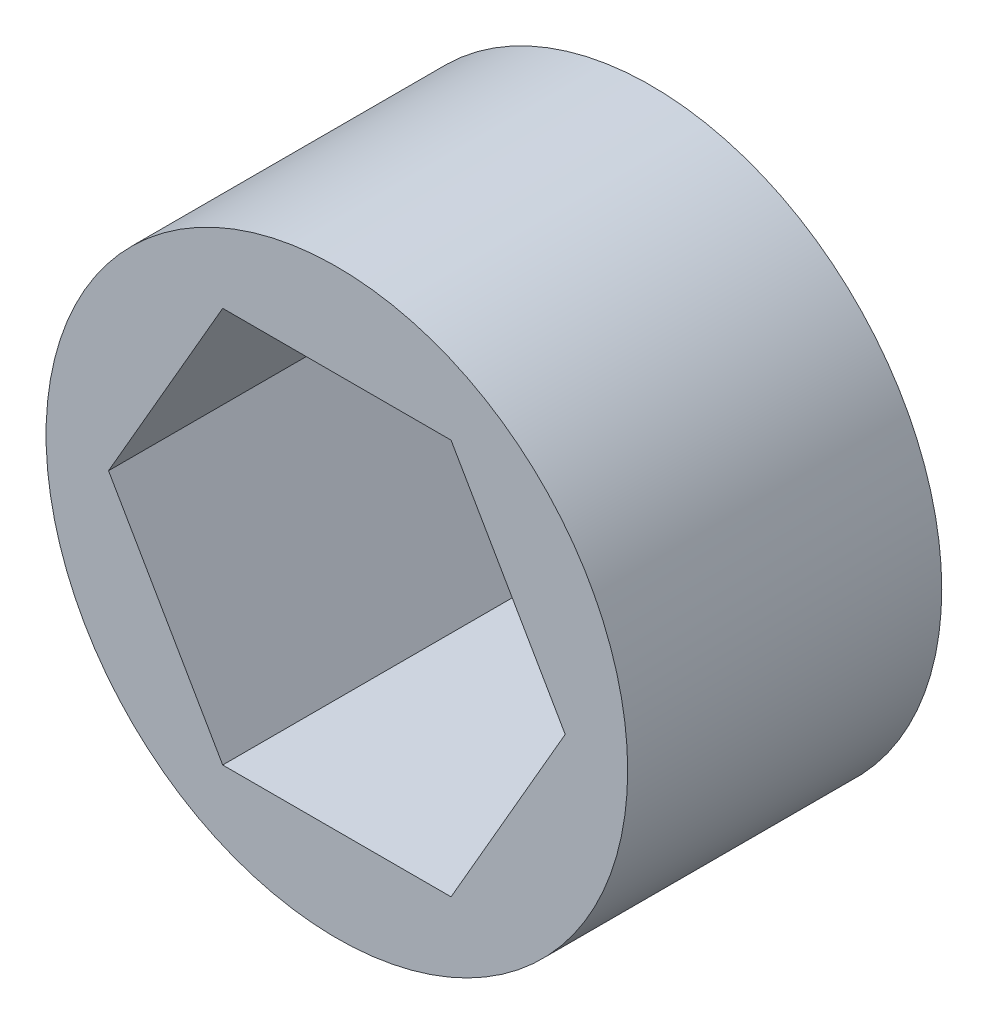
from build123d import *

# Parameters (mm, degrees)
SKETCH1_R           = 9.525
BOSS_EXTRUDE1_DEPTH = 5.1435


with BuildPart() as part:
    # Sketch1 → Boss-Extrude1 (new, symmetric)
    with BuildSketch(Plane.XY):
        Circle(SKETCH1_R)
        Polygon((7.478995387, 0), (3.739497694, 6.477), (-3.739497694, 6.477), (-7.478995387, 0), (-3.739497694, -6.477), (3.739497694, -6.477), align=None, mode=Mode.SUBTRACT)
    extrude(amount=BOSS_EXTRUDE1_DEPTH, both=True)


solid = part.part
